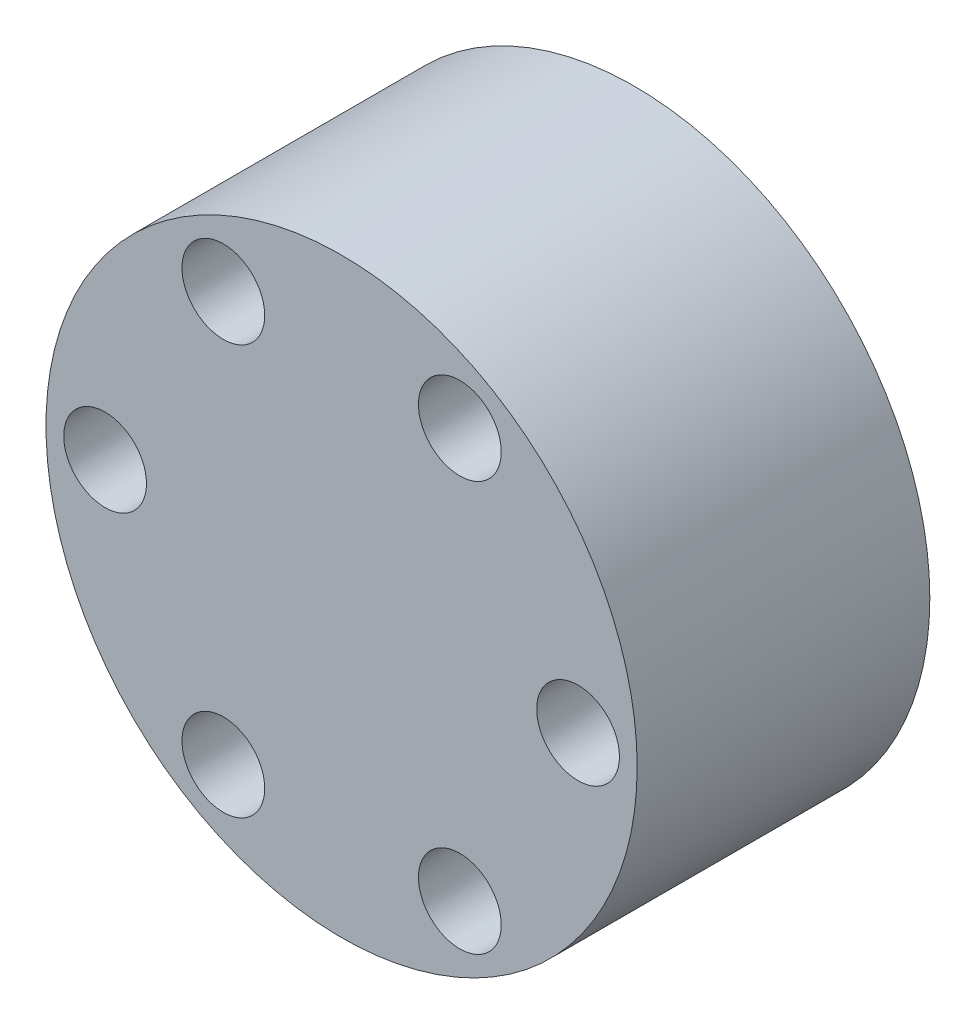
from build123d import *

# Parameters (mm, degrees)
SKETCH1_R           = 15
BOSS_EXTRUDE1_DEPTH = 7.425
SKETCH2_R           = 2.1
CUT_EXTRUDE1_DEPTH  = 26.894449212


with BuildPart() as part:
    # Sketch1 → Boss-Extrude1 (new, symmetric)
    with BuildSketch(Plane.XY):
        Circle(SKETCH1_R)
    extrude(amount=BOSS_EXTRUDE1_DEPTH, both=True)

    # Sketch2 → Cut-Extrude1 (cut, through all)
    with BuildSketch(Plane.XY.offset(7.425)):
        with Locations((-6, 10.392304845)):
            Circle(SKETCH2_R)
        with Locations((6, 10.392304845)):
            Circle(SKETCH2_R)
        with Locations((12, 0)):
            Circle(SKETCH2_R)
        with Locations((6, -10.392304845)):
            Circle(SKETCH2_R)
        with Locations((-6, -10.392304845)):
            Circle(SKETCH2_R)
        with Locations((-12, 0)):
            Circle(SKETCH2_R)
    extrude(amount=-CUT_EXTRUDE1_DEPTH, mode=Mode.SUBTRACT)


solid = part.part
